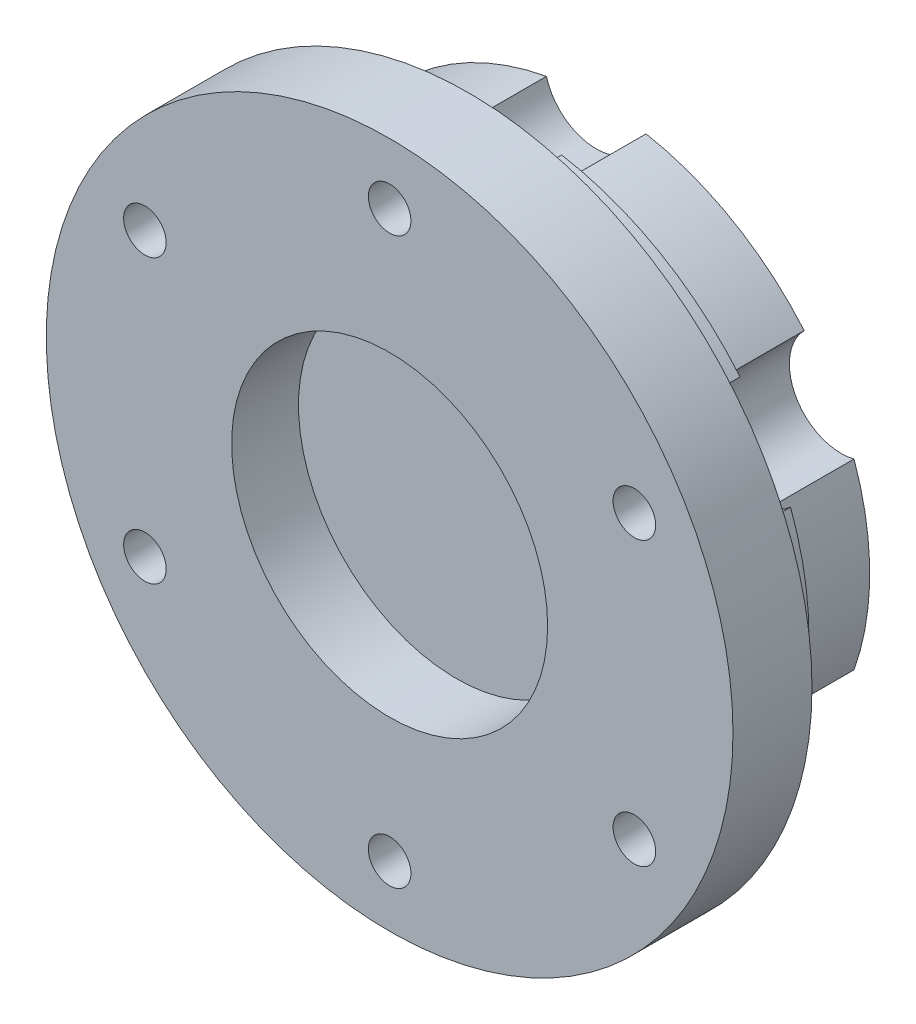
from build123d import *

# Parameters (mm, degrees)
SKETCH2_R                                       = 1.75
CUT_EXTRUDE1_DEPTH                              = 42.308292146
CIRPATTERN1_COUNT                               = 6
SKETCH5_R                                       = 1.75
CUT_EXTRUDE2_DEPTH                              = 10
CIRPATTERN2_COUNT                               = 6
SKETCH6_R                                       = 13
CUT_EXTRUDE3_DEPTH                              = 5.5
SKETCH7_R                                       = 4.25
SKETCH7_R_2                                     = 1.75
CUT_EXTRUDE4_DEPTH                              = 42.308292146
CIRPATTERN3_COUNT                               = 6
CSK_FOR_M3_FLAT_HEAD_MACHINE_SCREW1_D           = 3.4
CSK_FOR_M3_FLAT_HEAD_MACHINE_SCREW1_DEPTH       = 6.5
CSK_FOR_M3_FLAT_HEAD_MACHINE_SCREW1_CSINK_D     = 6.3
CSK_FOR_M3_FLAT_HEAD_MACHINE_SCREW1_CSINK_ANGLE = 90


with BuildPart() as part:
    # Sketch1 → Revolve1 (revolve)
    with BuildSketch(Plane(origin=(0, 0, 0), x_dir=(0, 0, -1), z_dir=(1, 0, 0)), mode=Mode.PRIVATE) as revolve1_sk:
        Polygon((0, 0), (0, 28.25), (6.5, 28.25), (6.5, 24.5), (10, 24.5), (10, 22.5), (17, 22.5), (17, 0), align=None)
    revolve(revolve1_sk.sketch.rotate(Axis((0, 0, 0), (0, 0, -1)), 90), axis=Axis((0, 0, 0), (0, 0, -1)))

    # Sketch2 → Cut-Extrude1 (cut, symmetric)
    with BuildSketch(Plane(origin=(0, 0, -6.5), x_dir=(-1, 0, 0), z_dir=(0, 0, -1))):
        with Locations((0, 23.25)):
            Circle(SKETCH2_R)
    cut_extrude1 = extrude(amount=CUT_EXTRUDE1_DEPTH, both=True, mode=Mode.SUBTRACT)

    # CirPattern1: Cut-Extrude1 ×6 about axis
    cirpattern1_axis = Axis((0, 0, 0), (0, 0, 1))
    for i in range(1, CIRPATTERN1_COUNT):
        add(cut_extrude1.rotate(cirpattern1_axis, i * 360 / CIRPATTERN1_COUNT), mode=Mode.SUBTRACT)

    # Sketch5 → Cut-Extrude2 (cut)
    with BuildSketch(Plane(origin=(0, 0, -17), x_dir=(-1, 0, 0), z_dir=(0, 0, -1))):
        with Locations((8.25, 14.289419162)):
            Circle(SKETCH5_R)
    cut_extrude2 = extrude(amount=-CUT_EXTRUDE2_DEPTH, mode=Mode.SUBTRACT)

    # CirPattern2: Cut-Extrude2 ×6 about axis
    cirpattern2_axis = Axis((0, 0, 0), (0, 0, 1))
    for i in range(1, CIRPATTERN2_COUNT):
        add(cut_extrude2.rotate(cirpattern2_axis, i * 360 / CIRPATTERN2_COUNT), mode=Mode.SUBTRACT)

    # Sketch6 → Cut-Extrude3 (cut)
    with BuildSketch(Plane.XY):
        Circle(SKETCH6_R)
    extrude(amount=-CUT_EXTRUDE3_DEPTH, mode=Mode.SUBTRACT)

    # Sketch7 → Cut-Extrude4 (cut, through all)
    with BuildSketch(Plane(origin=(0, 0, -6.5), x_dir=(-1, 0, 0), z_dir=(0, 0, -1))):
        with Locations((-20.135090638, 11.625)):
            Circle(SKETCH7_R)
        with Locations(Location((-20.135090638, 11.625, 0), (0, 0, 60))):
            Circle(SKETCH7_R_2, mode=Mode.SUBTRACT)
    cut_extrude4 = extrude(amount=CUT_EXTRUDE4_DEPTH, mode=Mode.SUBTRACT)

    # CirPattern3: Cut-Extrude4 ×6 about axis
    cirpattern3_axis = Axis((0, 0, 0), (0, 0, 1))
    for i in range(1, CIRPATTERN3_COUNT):
        add(cut_extrude4.rotate(cirpattern3_axis, i * 360 / CIRPATTERN3_COUNT), mode=Mode.SUBTRACT)

    # CSK for M3 Flat Head Machine Screw1
    with Locations(Plane(origin=(0, 0, -6.5), x_dir=(-1, 0, 0), z_dir=(0, 0, -1))):
        with Locations((-20.135090638, 11.625), (0, -23.25), (20.135090638, 11.625), (0, 23.25), (20.135090638, -11.625), (-20.135090638, -11.625)):
            CounterSinkHole(CSK_FOR_M3_FLAT_HEAD_MACHINE_SCREW1_D / 2, CSK_FOR_M3_FLAT_HEAD_MACHINE_SCREW1_CSINK_D / 2, depth=CSK_FOR_M3_FLAT_HEAD_MACHINE_SCREW1_DEPTH, counter_sink_angle=CSK_FOR_M3_FLAT_HEAD_MACHINE_SCREW1_CSINK_ANGLE)


solid = part.part
